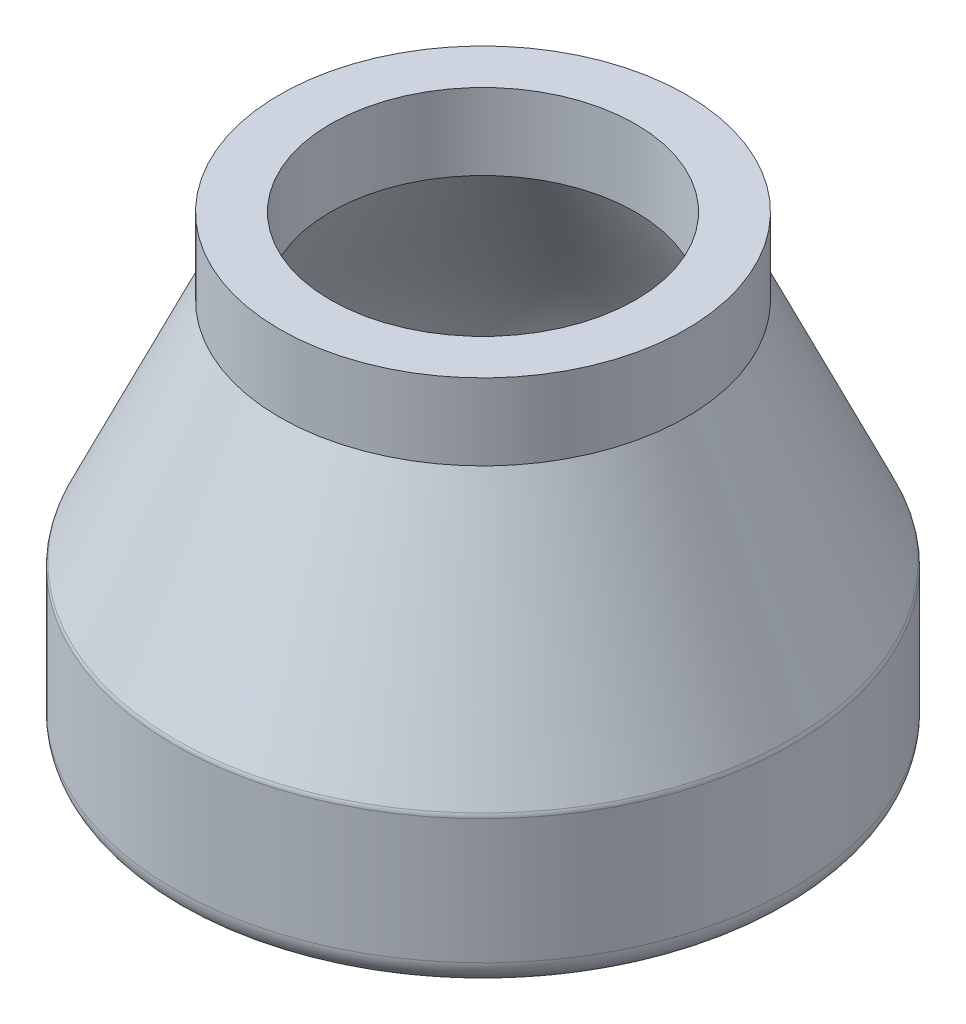
from build123d import *

# Parameters (mm, degrees)
SZKIC1_R                          = 12.15
SZKIC1_R_2                        = 10.15
WYCI_GNI_CIE_CIENKA_CIANKA1_DEPTH = 6
ZAOKR_GLENIE2_R                   = 1
ZAOKR_GLENIE3_R                   = 0.4
SZKIC6_R                          = 8
SZKIC6_R_2                        = 6
DODANIE_WYCI_GNI_CIE1_DEPTH       = 3


with BuildPart() as part:
    # Szkic1 → Wyciągnięcie-cienka ścianka1 (new body)
    with BuildSketch(Plane(origin=(0, 0, 0), x_dir=(1, 0, 0), z_dir=(0, 1, 0))):
        Circle(SZKIC1_R)
        Circle(SZKIC1_R_2, mode=Mode.SUBTRACT)
    extrude(amount=WYCI_GNI_CIE_CIENKA_CIANKA1_DEPTH)

    # Zaokrąglenie2
    zaokr_glenie2_edges = [part.edges().sort_by_distance(p)[0] for p in [
        (-12.15, 0, 0),
    ]]
    fillet(zaokr_glenie2_edges, radius=ZAOKR_GLENIE2_R)

    # Szkic4 → Wycięcie-obrót1 (revolve, cut)
    with BuildSketch(Plane(origin=(0, 0, 0), x_dir=(0, 0, -1), z_dir=(1, 0, 0)), mode=Mode.PRIVATE) as wyci_cie_obr_t1_sk:
        Polygon((0, 0), (10.15, 0), (10.4, 6), (0, 6), align=None)
    revolve(wyci_cie_obr_t1_sk.sketch.rotate(Axis((0, 6, 0), (0, -1, 0)), 180), axis=Axis((0, 6, 0), (0, -1, 0)), mode=Mode.SUBTRACT)

    # Szkic5 → Obrót1 (revolve)
    with BuildSketch(Plane(origin=(0, 0, 0), x_dir=(0, 0, -1), z_dir=(1, 0, 0)), mode=Mode.PRIVATE) as obr_t1_sk:
        with BuildLine():
            add(Edge.make_bspline(
                [(10.4, 6), (9.777490232, 8.738978154), (8.575284138, 10.423413973), (6, 15)],
                knots=[0, 0, 0, 0, 1, 1, 1, 1], degree=3))
            Line((10.4, 6), (12.15, 6))
            Line((12.15, 6), (8, 15))
            Line((8, 15), (6, 15))
        make_face()
    revolve(obr_t1_sk.sketch.rotate(Axis((0, 15, 0), (0, -1, 0)), 180), axis=Axis((0, 15, 0), (0, -1, 0)))

    # Zaokrąglenie3
    zaokr_glenie3_edges = [part.edges().sort_by_distance(p)[0] for p in [
        (0, 6, -10.4),
        (8.591347391, 6, 8.591347391),
    ]]
    fillet(zaokr_glenie3_edges, radius=ZAOKR_GLENIE3_R)

    # Szkic6 → Dodanie-wyciągnięcie1 (add)
    with BuildSketch(Plane(origin=(0, 15, 0), x_dir=(1, 0, 0), z_dir=(0, 1, 0))):
        with Locations(Location((0, 0, 0), (0, 0, 270))):
            Circle(SZKIC6_R)
        with Locations(Location((0, 0, 0), (0, 0, 270))):
            Circle(SZKIC6_R_2, mode=Mode.SUBTRACT)
    extrude(amount=DODANIE_WYCI_GNI_CIE1_DEPTH)


solid = part.part
